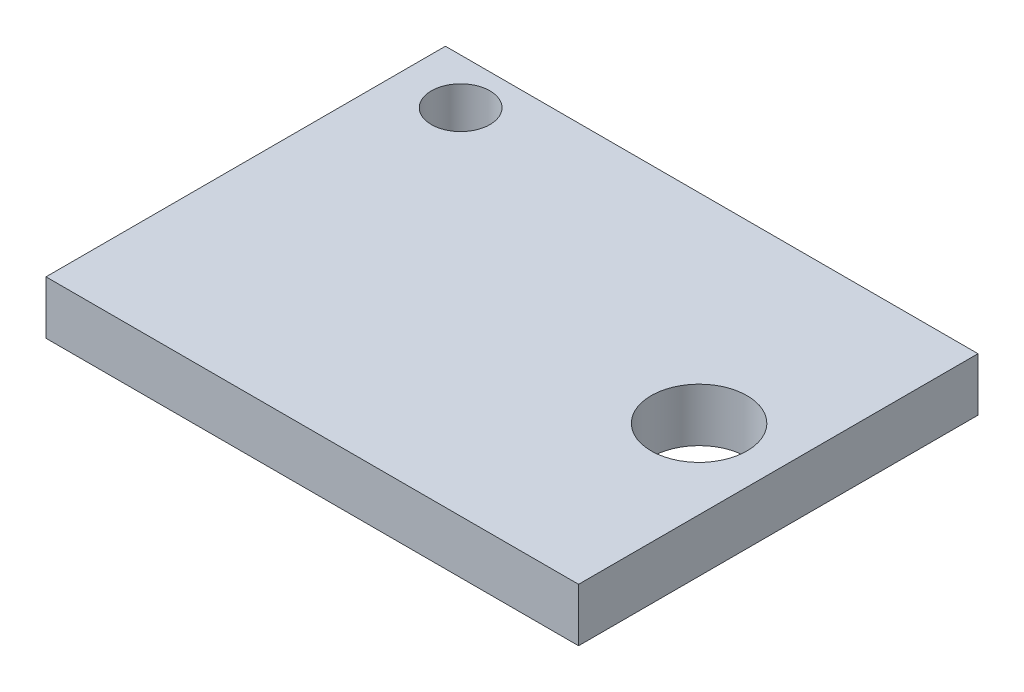
from build123d import *

# Parameters (mm, degrees)
SKETCH1_W           = 100
SKETCH1_H           = 75
SKETCH1_R           = 9
SKETCH1_R_2         = 5.5
BOSS_EXTRUDE1_DEPTH = 10


with BuildPart() as part:
    # Sketch1 → Boss-Extrude1 (new body)
    with BuildSketch(Plane(origin=(0, 0, 0), x_dir=(1, 0, 0), z_dir=(0, 1, 0))):
        Rectangle(SKETCH1_W, SKETCH1_H)
        with Locations(Location((35.130494505, 0, 0), (0, 0, 270))):
            Circle(SKETCH1_R, mode=Mode.SUBTRACT)
        with Locations(Location((-38.571428571, 28.928571429, 0), (0, 0, 270))):
            Circle(SKETCH1_R_2, mode=Mode.SUBTRACT)
    extrude(amount=BOSS_EXTRUDE1_DEPTH)


solid = part.part
